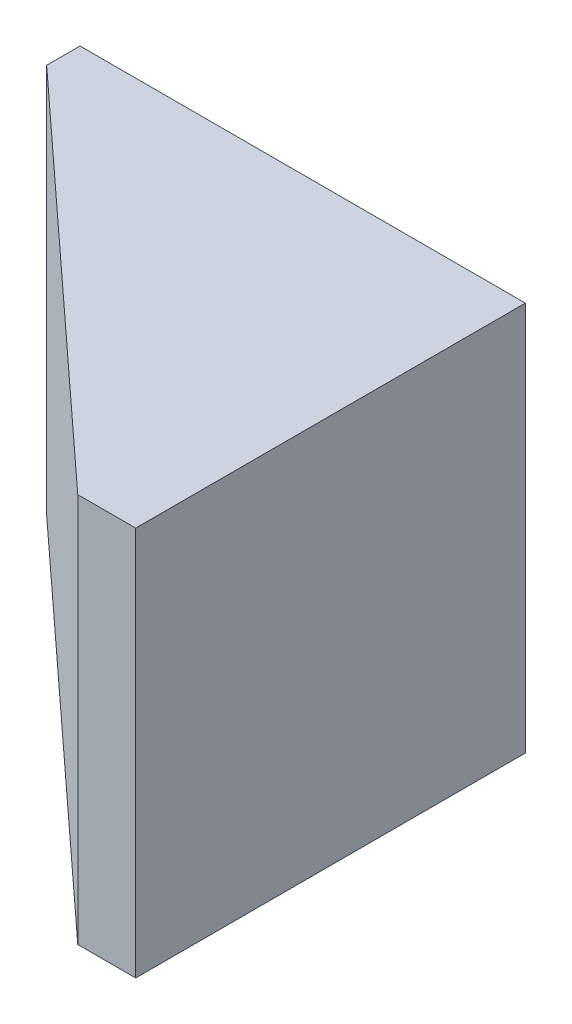
from build123d import *

# Parameters (mm, degrees)
BOSS_EXTRUDE1_DEPTH = 70


with BuildPart() as part:
    # Sketch1 → Boss-Extrude1 (new body)
    with BuildSketch(Plane(origin=(0, 0, 0), x_dir=(1, 0, 0), z_dir=(0, 1, 0))):
        Polygon((0, 0), (0, -6), (69.591918857, -70), (80, -70), (80, 0), align=None)
    extrude(amount=BOSS_EXTRUDE1_DEPTH)


solid = part.part
